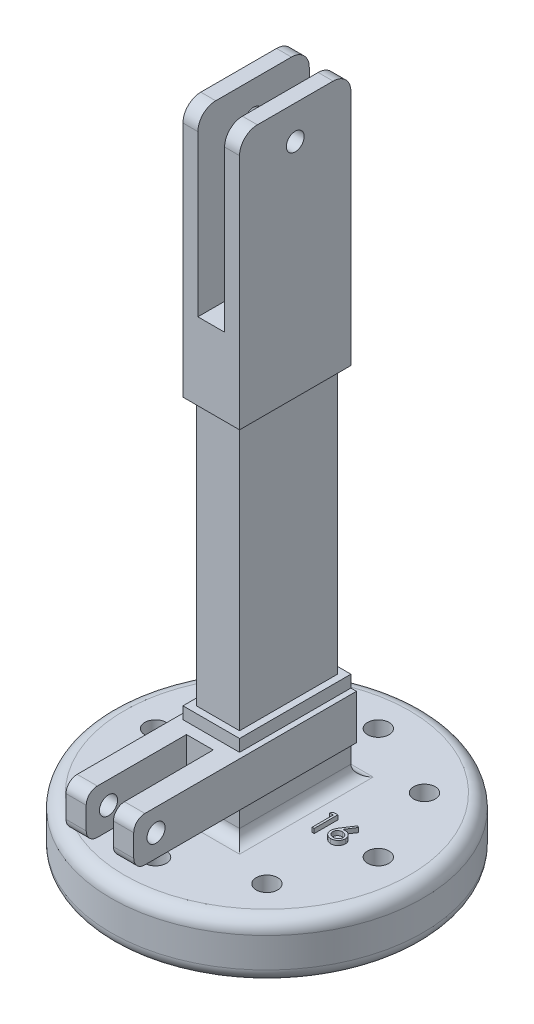
from build123d import *

# Parameters (mm, degrees)
SKETCH1_W               = 70
SKETCH1_H               = 70
BOSS_EXTRUDE1_DEPTH     = 12.7
SKETCH2_R               = 2
BOSS_EXTRUDE2_DEPTH     = 6.35
CUT_EXTRUDE2_DEPTH      = 158.955689989
CUT_EXTRUDE2_DEPTH_BACK = 12.7
SKETCH3_R               = 2.413
SKETCH4_R               = 2.032
BOSS_EXTRUDE4_DEPTH     = 7.6
CUT_EXTRUDE3_DEPTH      = 12.45
SKETCH6_W               = 6
SKETCH6_H               = 36
SKETCH6_H_2             = 4
CUT_EXTRUDE4_DEPTH      = 162.187003198
BOSS_EXTRUDE5_DEPTH     = 1
SKETCH8_OUTSIDE_W       = 108.142
SKETCH8_OUTSIDE_H       = 110.642
SKETCH8_OUTSIDE_R       = 35
CUT_EXTRUDE5_DEPTH      = 147.569232812
FILLET2_R               = 3
CUT_EXTRUDE6_START      = 20
SKETCH9_OUTSIDE_W       = 108.142
SKETCH9_OUTSIDE_H       = 110.642
SKETCH9_OUTSIDE_W_2     = 9.7
SKETCH9_OUTSIDE_H_2     = 22
CUT_EXTRUDE6_DEPTH      = 60
FILLET1_R               = 2.5


with BuildPart() as part:
    # Sketch1 → Boss-Extrude1 (new body)
    with BuildSketch(Plane(origin=(0, 0, 0), x_dir=(1, 0, 0), z_dir=(0, 1, 0))):
        Rectangle(SKETCH1_W, SKETCH1_H)
    extrude(amount=BOSS_EXTRUDE1_DEPTH)

    # Sketch2 → Boss-Extrude2 (add, symmetric)
    with BuildSketch(Plane(origin=(0, 0, 0), x_dir=(0, 0, -1), z_dir=(1, 0, 0))):
        with BuildLine():
            Line((-12.5, 0), (12.5, 0))
            Line((12.5, 0), (12.5, 146))
            ThreePointArc((12.5, 146), (11.328427125, 148.828427125), (8.5, 150))
            Line((8.5, 150), (-8.5, 150))
            ThreePointArc((-8.5, 150), (-11.328427125, 148.828427125), (-12.5, 146))
            Line((-12.5, 146), (-12.5, 0))
        make_face()
        with Locations((0, 142.5)):
            Circle(SKETCH2_R, mode=Mode.SUBTRACT)
    extrude(amount=BOSS_EXTRUDE2_DEPTH, both=True)

    # Sketch3 → Cut-Extrude2 (cut, two sides: drawn at the far end of the back side and taken through both)
    with BuildSketch(Plane(origin=(0, 0, 0), x_dir=(1, 0, 0), z_dir=(0, 1, 0)).offset(-CUT_EXTRUDE2_DEPTH_BACK)):
        with Locations(Location((17.67766953, -17.67766953, 0), (0, 0, 270))):
            Circle(SKETCH3_R)
        with Locations(Location((25, 0, 0), (0, 0, 270))):
            Circle(SKETCH3_R)
        with Locations(Location((17.67766953, 17.67766953, 0), (0, 0, 270))):
            Circle(SKETCH3_R)
        with Locations(Location((0, 25, 0), (0, 0, 270))):
            Circle(SKETCH3_R)
        with Locations(Location((-17.67766953, 17.67766953, 0), (0, 0, 270))):
            Circle(SKETCH3_R)
        with Locations(Location((-25, 0, 0), (0, 0, 270))):
            Circle(SKETCH3_R)
        with Locations(Location((-17.67766953, -17.67766953, 0), (0, 0, 270))):
            Circle(SKETCH3_R)
        with Locations(Location((0, -25, 0), (0, 0, 270))):
            Circle(SKETCH3_R)
    extrude(amount=CUT_EXTRUDE2_DEPTH + CUT_EXTRUDE2_DEPTH_BACK, mode=Mode.SUBTRACT)

    # Sketch4 → Boss-Extrude4 (add, symmetric)
    with BuildSketch(Plane(origin=(0, 0, 0), x_dir=(0, 0, -1), z_dir=(1, 0, 0))):
        with BuildLine():
            Line((12.5, 20), (-35, 20))
            ThreePointArc((-35, 20), (-36.767766953, 20.732233047), (-37.5, 22.5))
            Line((-37.5, 22.5), (-37.5, 27.5))
            ThreePointArc((-37.5, 27.5), (-36.767766953, 29.267766953), (-35, 30))
            Line((-35, 30), (12.5, 30))
            Line((12.5, 30), (12.5, 20))
        make_face()
        with Locations(Location((-32.5, 25, 0), (0, 0, 180))):
            Circle(SKETCH4_R, mode=Mode.SUBTRACT)
    extrude(amount=BOSS_EXTRUDE4_DEPTH, both=True)

    # Sketch5 → Cut-Extrude3 (cut)
    with BuildSketch(Plane(origin=(0, 30, 0), x_dir=(1, 0, 0), z_dir=(0, 1, 0))):
        Polygon((-3.070505438, -14.989300838), (-3.070505438, -44.384490964), (3.070505438, -44.384490964), (2.929494562, -14.989300838), align=None)
    extrude(amount=-CUT_EXTRUDE3_DEPTH, mode=Mode.SUBTRACT)

    # Sketch6 → Cut-Extrude4 (cut, through all)
    with BuildSketch(Plane.XY.offset(12.5)):
        with Locations((0, 128)):
            Rectangle(SKETCH6_W, SKETCH6_H)
        with Locations((0, 148)):
            Rectangle(SKETCH6_W, SKETCH6_H_2)
    extrude(amount=-CUT_EXTRUDE4_DEPTH, mode=Mode.SUBTRACT)

    # Sketch7 → Boss-Extrude5 (add)
    # profile 1 of 2: a face of its own
    with BuildSketch(Plane(origin=(0, 12.7, 0), x_dir=(1, 0, 0), z_dir=(0, 1, 0))):
        Polygon((12.240261351, 2.686742079), (13.218668469, 2.686742079), (13.218668469, -2.604924587), (12.743775307, -2.604924587), (12.743775307, 2.144007037), (11.929672742, 2.144007037), align=None)
    # profile 2 of 2: a face of its own
    with BuildSketch(Plane(origin=(0, 12.7, 0), x_dir=(1, 0, 0), z_dir=(0, 1, 0))):
        with BuildLine():
            Line((17.628390691, 2.82242584), (17.994100827, 2.535157878))
            Line((17.994100827, 2.535157878), (16.595922075, 0.397078618))
            add(Edge.make_bspline(
                [(16.595922075, 0.397078618), (16.68901047, 0.411916241), (16.870589909, 0.440858701), (17.05438597, 0.445633214), (17.143957264, 0.447960028)],
                knots=[0, 0, 0, 0, 1.025318673, 2, 2, 2, 2], degree=3))
            add(Edge.make_bspline(
                [(17.143957264, 0.447960028), (17.197739491, 0.446514478), (17.303608204, 0.443668956), (17.459042297, 0.421770754), (17.60840176, 0.387261358), (17.751067531, 0.336956876), (17.887551682, 0.272697364), (18.018637448, 0.195682644), (18.141860725, 0.10193596), (18.258808341, -0.002786056), (18.364985024, -0.118774831), (18.458989298, -0.241845899), (18.537951234, -0.371871041), (18.602016567, -0.508784397), (18.65176561, -0.652374921), (18.688032645, -0.802458894), (18.709470839, -0.959139809), (18.712381997, -1.065696098), (18.713860777, -1.119823425)],
                knots=[0, 0, 0, 0, 1.04369286, 2.054478336, 3.041073146, 4.015093852, 4.984733326, 5.965804835, 6.960378782, 7.985147595, 9.009457201, 10.008161701, 10.986880575, 11.956520048, 12.937015923, 13.931873656, 14.949455224, 16, 16, 16, 16], degree=3))
            add(Edge.make_bspline(
                [(18.713860777, -1.119823425), (18.711709178, -1.193876073), (18.70747534, -1.339594158), (18.665287458, -1.551830369), (18.599731804, -1.754021196), (18.506027684, -1.942938491), (18.389637653, -2.118323329), (18.247703673, -2.273725163), (18.085259352, -2.412321529), (17.901582883, -2.528219037), (17.703911973, -2.622868888), (17.496248834, -2.690852051), (17.280610172, -2.73270682), (17.134250824, -2.737954041), (17.060214943, -2.740608348)],
                knots=[0, 0, 0, 0, 1.031375318, 2.029502543, 3.004789286, 3.987476834, 4.960371455, 5.9300674, 6.912260825, 7.929083631, 8.949397511, 9.960523116, 10.96833055, 12, 12, 12, 12], degree=3))
            add(Edge.make_bspline(
                [(17.060214943, -2.740608348), (16.989009217, -2.738297846), (16.847963141, -2.733721147), (16.640480226, -2.692951218), (16.441115902, -2.626870241), (16.251266957, -2.535831986), (16.075401269, -2.420839711), (15.918063938, -2.282406265), (15.780039469, -2.123490764), (15.665173078, -1.944117858), (15.574067614, -1.751365184), (15.505744751, -1.550376865), (15.465836145, -1.341885226), (15.460259398, -1.200550646), (15.45745052, -1.12936369)],
                knots=[0, 0, 0, 0, 1.012016664, 2.004627821, 2.994792927, 3.992885782, 4.990978636, 5.973936114, 6.964471063, 7.975201453, 8.993600317, 9.990122807, 10.98767138, 12, 12, 12, 12], degree=3))
            add(Edge.make_bspline(
                [(15.45745052, -1.12936369), (15.459236753, -1.074867713), (15.462883898, -0.96359734), (15.4883495, -0.795074346), (15.529268892, -0.622639972), (15.575095098, -0.476356846), (15.62351477, -0.356520973), (15.663810872, -0.259904982), (15.713966794, -0.160480502), (15.767447978, -0.054838219), (15.829068482, 0.05429928), (15.896069523, 0.168756019), (15.970303519, 0.286711695), (16.022343527, 0.366758276), (16.048946914, 0.407678912)],
                knots=[0, 0, 0, 0, 1.173818275, 2.396712641, 3.66331629, 4.989737886, 5.693666774, 6.447286557, 7.243889047, 8.091586357, 8.998013824, 9.943181721, 10.948533338, 12, 12, 12, 12], degree=3))
            Line((16.048946914, 0.407678912), (17.628390691, 2.82242584))
        make_face()
        with BuildLine():
            add(Edge.make_bspline(
                [(17.044314503, -0.094775015), (17.004003728, -0.095951343), (16.925265074, -0.098249053), (16.80974434, -0.111591993), (16.700413591, -0.136718438), (16.595824353, -0.168719916), (16.497931993, -0.21272097), (16.406025056, -0.266169523), (16.319748133, -0.329096781), (16.240004906, -0.400611254), (16.167706129, -0.478909827), (16.105444181, -0.562774462), (16.051737695, -0.650184031), (16.008071136, -0.741868872), (15.974068283, -0.837793937), (15.949472237, -0.93751804), (15.935783828, -1.041709908), (15.933506549, -1.112365001), (15.932343683, -1.148444219)],
                knots=[0, 0, 0, 0, 1.129588631, 2.206414736, 3.251139165, 4.268635594, 5.265702196, 6.250456724, 7.242448911, 8.251968645, 9.246821453, 10.222880186, 11.173611482, 12.116736599, 13.062300278, 14.020270554, 14.989073742, 16, 16, 16, 16], degree=3))
            add(Edge.make_bspline(
                [(15.932343683, -1.148444219), (15.933290682, -1.184200736), (15.935147605, -1.254313943), (15.952008851, -1.357636274), (15.977764273, -1.457066552), (16.016076538, -1.552092184), (16.061776714, -1.644161617), (16.122109764, -1.729939965), (16.188961333, -1.814636976), (16.268871447, -1.891746343), (16.354631769, -1.96349624), (16.446255016, -2.026210432), (16.54174686, -2.079862147), (16.64239651, -2.121909878), (16.746775972, -2.156418026), (16.855754904, -2.180701453), (16.969409103, -2.194430343), (17.046398223, -2.196710588), (17.085655648, -2.197873305)],
                knots=[0, 0, 0, 0, 0.989467248, 1.94019797, 2.891935182, 3.827694429, 4.772920941, 5.730924762, 6.725747692, 7.756678648, 8.79901574, 9.819492441, 10.826891316, 11.826466727, 12.835195252, 13.867842842, 14.912794438, 16, 16, 16, 16], degree=3))
            add(Edge.make_bspline(
                [(17.085655648, -2.197873305), (17.124913009, -2.196710497), (17.201902004, -2.194430073), (17.315557116, -2.180702479), (17.424532669, -2.156414261), (17.528924415, -2.121923525), (17.629528721, -2.07981152), (17.72493705, -2.026544213), (17.81569381, -1.963110559), (17.901510431, -1.891868959), (17.981087933, -1.814198099), (18.049542867, -1.730696019), (18.108028231, -1.643468344), (18.155553728, -1.552454868), (18.193444014, -1.457009095), (18.219330042, -1.357651667), (18.236156467, -1.254309913), (18.238018175, -1.184199375), (18.238967614, -1.148444219)],
                knots=[0, 0, 0, 0, 1.087397944, 2.132534446, 3.165364764, 4.174271784, 5.174024072, 6.181601208, 7.194203697, 8.236725232, 9.267838612, 10.269026844, 11.221737037, 12.171628256, 13.107553087, 14.05945871, 15.010357665, 16, 16, 16, 16], degree=3))
            add(Edge.make_bspline(
                [(18.238967614, -1.148444219), (18.238135624, -1.112317933), (18.236502697, -1.041413784), (18.218033346, -0.937564647), (18.19241809, -0.837287252), (18.153738984, -0.741211829), (18.103488494, -0.64971751), (18.042281438, -0.562342114), (17.971475052, -0.478415755), (17.889684724, -0.4004577), (17.800648299, -0.329175808), (17.705979497, -0.266251003), (17.60693768, -0.213145383), (17.503623267, -0.168835836), (17.39485248, -0.136859845), (17.282381372, -0.111681728), (17.164771446, -0.098283201), (17.08497824, -0.095959305), (17.044314503, -0.094775015)],
                knots=[0, 0, 0, 0, 0.978206639, 1.919901502, 2.851605144, 3.780102724, 4.718870031, 5.675451981, 6.667674623, 7.690630536, 8.733308323, 9.756129687, 10.767539656, 11.776269907, 12.797430371, 13.836405707, 14.897401972, 16, 16, 16, 16], degree=3))
        make_face(mode=Mode.SUBTRACT)
    extrude(amount=BOSS_EXTRUDE5_DEPTH)

    # Sketch8 outside → Cut-Extrude5 (cut, through all)
    with BuildSketch(Plane(origin=(0, 12.7, 0), x_dir=(1, 0, 0), z_dir=(0, 1, 0))):
        with Locations((0, -1.25)):
            Rectangle(SKETCH8_OUTSIDE_W, SKETCH8_OUTSIDE_H)
        with Locations(Location((0, 0, 0), (0, 0, 270))):
            Circle(SKETCH8_OUTSIDE_R, mode=Mode.SUBTRACT)
    extrude(amount=-CUT_EXTRUDE5_DEPTH, mode=Mode.SUBTRACT)

    # Fillet2
    fillet2_edges = [part.edges().sort_by_distance(p)[0] for p in [
        (0, 0, -35),
        (0, 12.7, -35),
    ]]
    fillet(fillet2_edges, radius=FILLET2_R)

    # Sketch9 outside → Cut-Extrude6 (cut)
    with BuildSketch(Plane(origin=(0, 12.7, 0), x_dir=(1, 0, 0), z_dir=(0, 1, 0)).offset(CUT_EXTRUDE6_START)):
        with Locations((0, -1.25)):
            Rectangle(SKETCH9_OUTSIDE_W, SKETCH9_OUTSIDE_H)
        Rectangle(SKETCH9_OUTSIDE_W_2, SKETCH9_OUTSIDE_H_2, mode=Mode.SUBTRACT)
    extrude(amount=CUT_EXTRUDE6_DEPTH, mode=Mode.SUBTRACT)

    # Fillet1
    fillet1_edges = [part.edges().sort_by_distance(p)[0] for p in [
        (-6.35, 12.7, 0),
        (0, 12.7, 12.5),
        (0, 12.7, -12.5),
        (6.35, 12.7, 0),
    ]]
    fillet(fillet1_edges, radius=FILLET1_R)


solid = part.part
